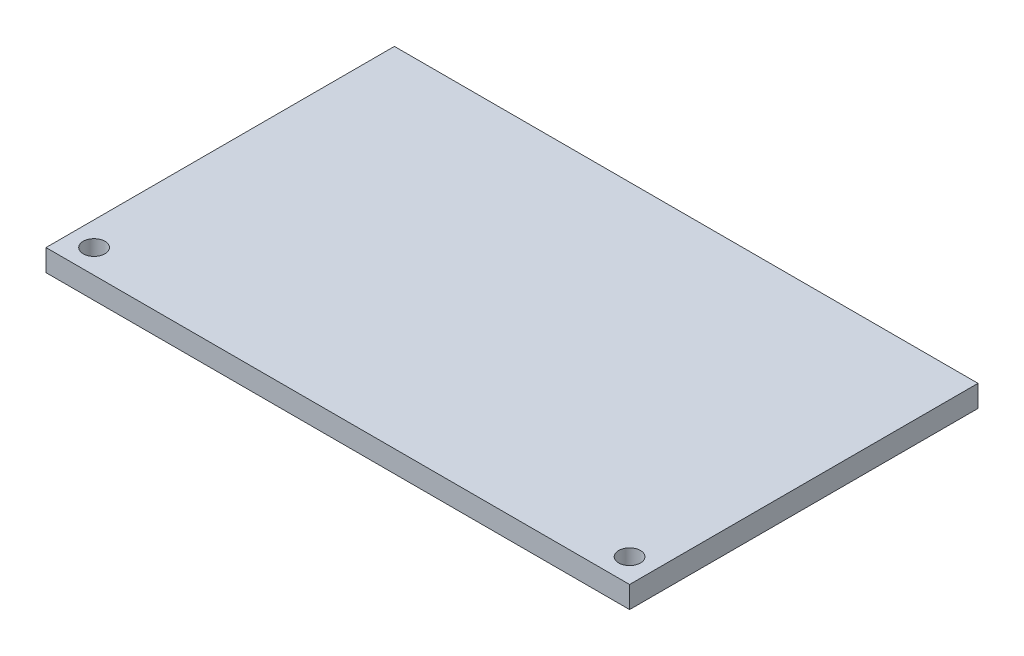
from build123d import *

# Parameters (mm, degrees)
SKETCH1_W           = 85.09
SKETCH1_H           = 50.8
SKETCH1_R           = 1.5875
BOSS_EXTRUDE1_DEPTH = 3.175


with BuildPart() as part:
    # Sketch1 → Boss-Extrude1 (new body)
    with BuildSketch(Plane(origin=(0, 0, 0), x_dir=(1, 0, 0), z_dir=(0, 1, 0))):
        with Locations((42.545, 25.4)):
            Rectangle(SKETCH1_W, SKETCH1_H)
        with Locations(Location((3.5052, 3.5052, 0), (0, 0, 270))):
            Circle(SKETCH1_R, mode=Mode.SUBTRACT)
        with Locations(Location((81.5848, 3.5052, 0), (0, 0, 270))):
            Circle(SKETCH1_R, mode=Mode.SUBTRACT)
    extrude(amount=BOSS_EXTRUDE1_DEPTH)


solid = part.part
